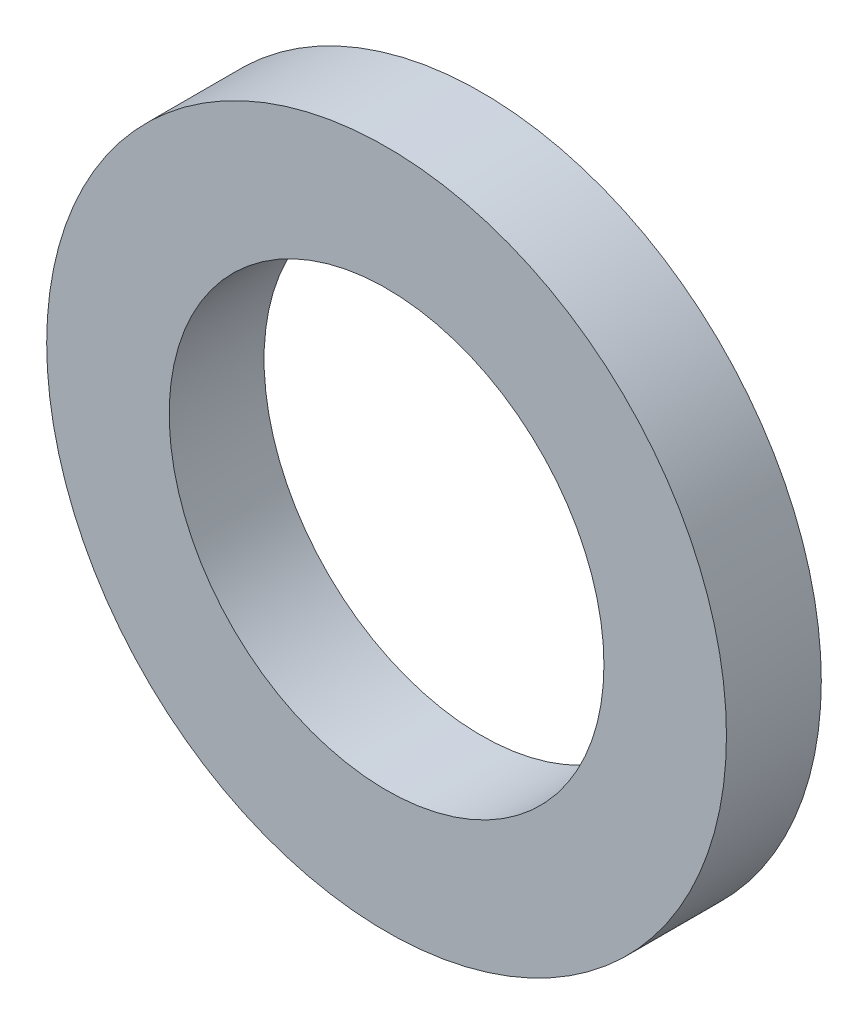
from build123d import *

# Parameters (mm, degrees)
SKETCH1_R           = 43
SKETCH1_R_2         = 27.5
BOSS_EXTRUDE1_DEPTH = 12


with BuildPart() as part:
    # Sketch1 → Boss-Extrude1 (new body)
    with BuildSketch(Plane.XY):
        Circle(SKETCH1_R)
        Circle(SKETCH1_R_2, mode=Mode.SUBTRACT)
    extrude(amount=BOSS_EXTRUDE1_DEPTH)


solid = part.part
